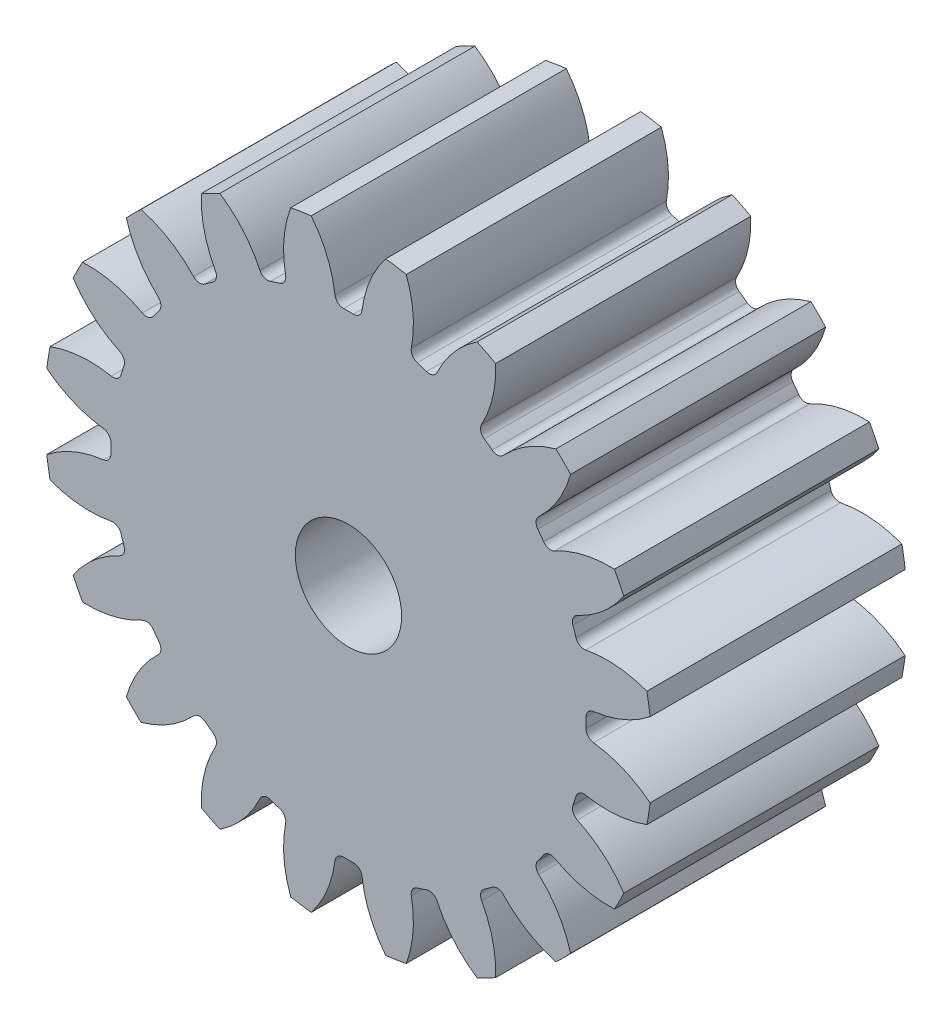
from build123d import *

# Parameters (mm, degrees)
SKETCH1_R                = 7.15
BOSS_EXTRUDE1_DEPTH      = 3
CUT_EXTRUDE1_DEPTH       = 11.547274529
FILLET1_R                = 0.2
CIRPATTERN1_COUNT        = 20
FILLET1_OF_CIRPATTERN1_R = 0.2
SKETCH5_R                = 1.25
CUT_EXTRUDE2_DEPTH       = 10


with BuildPart() as part:
    # Sketch1 → Boss-Extrude1 (new, symmetric)
    with BuildSketch(Plane.XY):
        Circle(SKETCH1_R)
    extrude(amount=BOSS_EXTRUDE1_DEPTH, both=True)

    # Sketch2 → Cut-Extrude1 (cut, symmetric)
    with BuildSketch(Plane.XY):
        with BuildLine():
            ThreePointArc((-1.167868761, 7.408514194), (-0.555089523, 6.580407607), (-0.301849702, 5.581844387))
            ThreePointArc((-0.301849702, 5.581844387), (0, 5.59), (0.301849702, 5.581844387))
            ThreePointArc((0.301849702, 5.581844387), (0.555089523, 6.580407607), (1.167868761, 7.408514194))
            ThreePointArc((1.167868761, 7.408514194), (0, 7.5), (-1.167868761, 7.408514194))
        make_face()
    cut_extrude1 = extrude(amount=CUT_EXTRUDE1_DEPTH, both=True, mode=Mode.SUBTRACT)

    # Fillet1
    fillet1_edges = [part.edges().sort_by_distance(p)[0] for p in [
        (-0.301849702, 5.581844387, 0),
        (0.301849702, 5.581844387, 0),
    ]]
    fillet(fillet1_edges, radius=FILLET1_R)

    # CirPattern1: Cut-Extrude1 ×20 about axis
    cirpattern1_axis = Axis((0, 0, 0), (0, 0, 1))
    for i in range(1, CIRPATTERN1_COUNT):
        add(cut_extrude1.rotate(cirpattern1_axis, i * 360 / CIRPATTERN1_COUNT), mode=Mode.SUBTRACT)

    # Fillet1 of CirPattern1
    fillet1_of_cirpattern1_edges = [part.edges().sort_by_distance(p)[0] for p in [
        (-2.011960902, 5.215372789, 0),
        (-1.437808649, 5.401926165, 0),
        (-3.52512735, 4.338384165, 0),
        (-3.036724272, 4.693229772, 0),
        (-4.693229772, 3.036724272, 0),
        (-4.338384165, 3.52512735, 0),
        (-5.401926165, 1.437808649, 0),
        (-5.215372789, 2.011960902, 0),
        (-5.581844387, -0.301849702, 0),
        (-5.581844387, 0.301849702, 0),
        (-5.215372789, -2.011960902, 0),
        (-5.401926165, -1.437808649, 0),
        (-4.338384165, -3.52512735, 0),
        (-4.693229772, -3.036724272, 0),
        (-3.036724272, -4.693229772, 0),
        (-3.52512735, -4.338384165, 0),
        (-1.437808649, -5.401926165, 0),
        (-2.011960902, -5.215372789, 0),
        (0.301849702, -5.581844387, 0),
        (-0.301849702, -5.581844387, 0),
        (2.011960902, -5.215372789, 0),
        (1.437808649, -5.401926165, 0),
        (3.52512735, -4.338384165, 0),
        (3.036724272, -4.693229772, 0),
        (4.693229772, -3.036724272, 0),
        (4.338384165, -3.52512735, 0),
        (5.401926165, -1.437808649, 0),
        (5.215372789, -2.011960902, 0),
        (5.581844387, 0.301849702, 0),
        (5.581844387, -0.301849702, 0),
        (5.215372789, 2.011960902, 0),
        (5.401926165, 1.437808649, 0),
        (4.338384165, 3.52512735, 0),
        (4.693229772, 3.036724272, 0),
        (3.036724272, 4.693229772, 0),
        (3.52512735, 4.338384165, 0),
        (1.437808649, 5.401926165, 0),
        (2.011960902, 5.215372789, 0),
    ]]
    fillet(fillet1_of_cirpattern1_edges, radius=FILLET1_OF_CIRPATTERN1_R)

    # Sketch5 → Cut-Extrude2 (cut)
    with BuildSketch(Plane(origin=(0, 0, -3), x_dir=(-1, 0, 0), z_dir=(0, 0, -1))):
        Circle(SKETCH5_R)
    extrude(amount=-CUT_EXTRUDE2_DEPTH, mode=Mode.SUBTRACT)


solid = part.part
